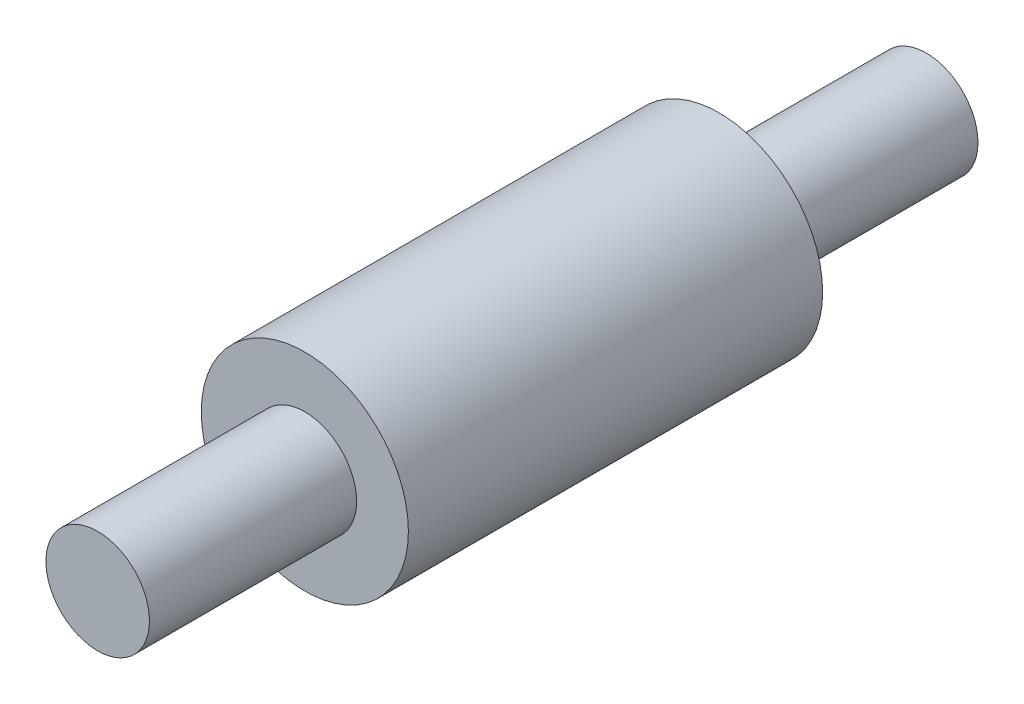
from build123d import *

# Parameters (mm, degrees)
SKETCH1_R           = 2.5
BOSS_EXTRUDE1_DEPTH = 10
SKETCH2_R           = 5
BOSS_EXTRUDE2_DEPTH = 20
SKETCH3_R           = 2.5
BOSS_EXTRUDE3_DEPTH = 10


with BuildPart() as part:
    # Sketch1 → Boss-Extrude1 (new body)
    with BuildSketch(Plane.XY):
        Circle(SKETCH1_R)
    extrude(amount=BOSS_EXTRUDE1_DEPTH)

    # Sketch2 → Boss-Extrude2 (add)
    with BuildSketch(Plane.XY.offset(10)):
        Circle(SKETCH2_R)
    extrude(amount=BOSS_EXTRUDE2_DEPTH)

    # Sketch3 → Boss-Extrude3 (add)
    with BuildSketch(Plane.XY.offset(30)):
        Circle(SKETCH3_R)
    extrude(amount=BOSS_EXTRUDE3_DEPTH)


solid = part.part
